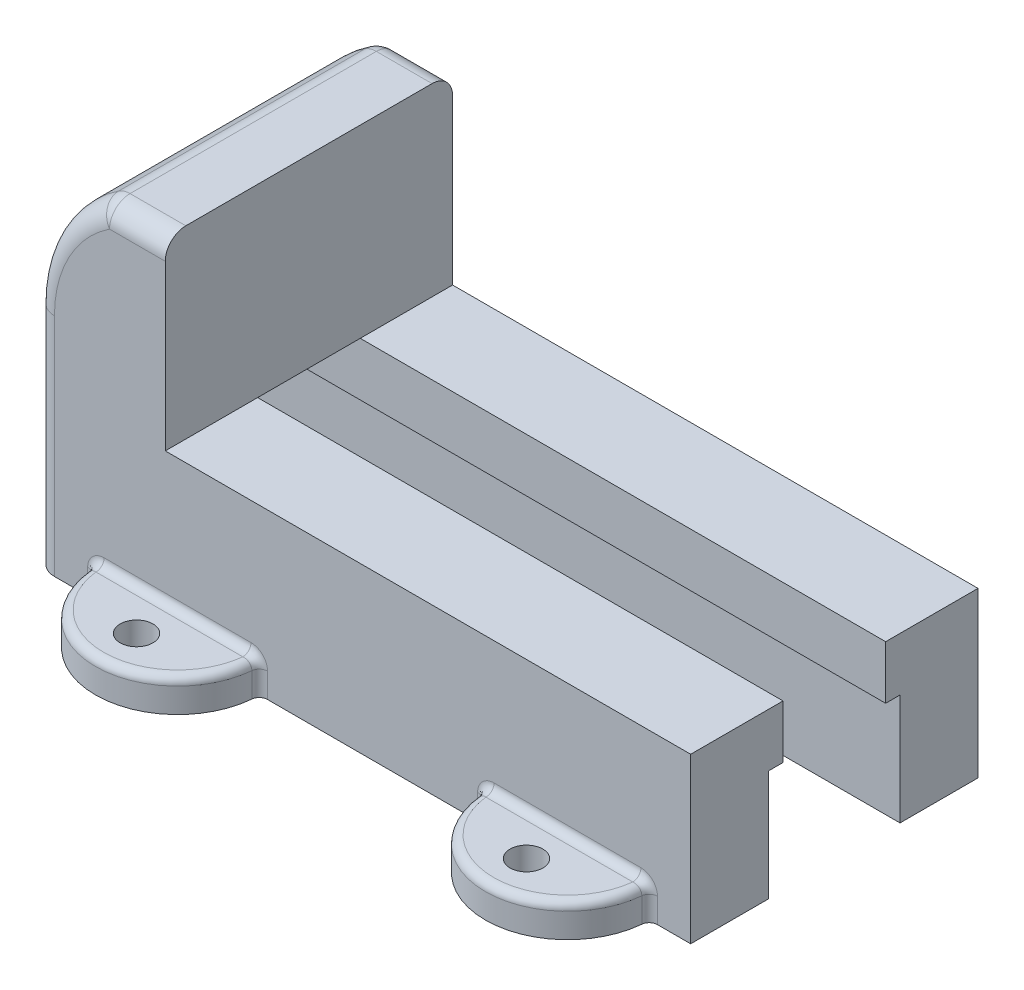
from build123d import *

# Parameters (mm, degrees)
SKETCH1_W                      = 185
SKETCH1_H                      = 40
EXTRUDE1_DEPTH                 = 35
EXTRUDE2_DEPTH                 = 70
EXTRUDE3_DEPTH                 = 25
CUT_EXTRUDE1_DEPTH             = 207.579282601
EXTRUDE4_DEPTH                 = 8
EXTRUDE5_DEPTH                 = 8
F_8_0_8_DIAMETER_HOLE1_D       = 8
F_14_0_14_DIAMETER_HOLE1_D     = 14
F_14_0_14_DIAMETER_HOLE1_DEPTH = 25
FILLET1_R                      = 2
FILLET2_R                      = 2
FILLET3_R                      = 2
FILLET10_R                     = 5
CUT_EXTRUDE2_DEPTH             = 223.598292936
CUT_EXTRUDE2_DEPTH_BACK        = 223.598292936


with BuildPart() as part:
    # Sketch1 → Extrude1 (new, symmetric)
    with BuildSketch(Plane.XY):
        with Locations((92.5, 20)):
            Rectangle(SKETCH1_W, SKETCH1_H)
    extrude(amount=EXTRUDE1_DEPTH, both=True)

    # Sketch2 → Extrude2 (add)
    with BuildSketch(Plane.XY.offset(35)):
        with BuildLine():
            Line((0, 40), (32, 40))
            Line((32, 40), (32, 85))
            Line((32, 85), (16.972243623, 85))
            ThreePointArc((16.972243623, 85), (4.537141687, 72.234101758), (0, 55))
            Line((0, 55), (0, 40))
        make_face()
    extrude(amount=-EXTRUDE2_DEPTH)

    # Sketch3 → Extrude3 (add)
    with BuildSketch(Plane(origin=(185, 0, 0), x_dir=(0, 0, -1), z_dir=(1, 0, 0))):
        with BuildLine():
            Line((-35, 40), (35, 40))
            Line((35, 40), (35, 55))
            Line((35, 55), (17, 55))
            ThreePointArc((17, 55), (0, 72), (-17, 55))
            Line((-17, 55), (-35, 55))
            Line((-35, 55), (-35, 40))
        make_face()
    extrude(amount=-EXTRUDE3_DEPTH)

    # Sketch4 → Cut-Extrude1 (cut, through all)
    with BuildSketch(Plane(origin=(185, 0, 0), x_dir=(0, 0, -1), z_dir=(1, 0, 0))):
        Polygon((-16, 0), (16, 0), (16, 27), (12.5, 27), (12.5, 40), (-12.5, 40), (-12.5, 27), (-16, 27), align=None)
    extrude(amount=-CUT_EXTRUDE1_DEPTH, mode=Mode.SUBTRACT)

    # Sketch5 → Extrude4 (add)
    with BuildSketch(Plane.XZ):
        with BuildLine():
            Line((15, 35), (55, 35))
            ThreePointArc((55, 35), (35, 55), (15, 35))
        make_face()
    extrude4 = extrude(amount=-EXTRUDE4_DEPTH)

    # Sketch6 → Extrude5 (add)
    with BuildSketch(Plane.XZ):
        with BuildLine():
            Line((110, 35), (150, 35))
            ThreePointArc((150, 35), (130, 55), (110, 35))
        make_face()
    extrude5 = extrude(amount=-EXTRUDE5_DEPTH)

    # Mirror1: Extrude4, Extrude5 across plane
    add(extrude4.mirror(Plane.XY))
    add(extrude5.mirror(Plane.XY))

    # Ø8.0 (8) Diameter Hole1 (through all)
    with Locations(Plane(origin=(0, 8, 0), x_dir=(-1, 0, 0), z_dir=(0, 1, 0))):
        with Locations((-35, 45), (-130, 45), (-35, -45), (-130, -45)):
            Hole(F_8_0_8_DIAMETER_HOLE1_D / 2)

    # Ø14.0 (14) Diameter Hole1
    with Locations(Plane(origin=(185, 0, 0), x_dir=(0, 0, -1), z_dir=(1, 0, 0))):
        with Locations((0, 55)):
            Hole(F_14_0_14_DIAMETER_HOLE1_D / 2, depth=F_14_0_14_DIAMETER_HOLE1_DEPTH)

    # Fillet1
    fillet1_edges = [part.edges().sort_by_distance(p)[0] for p in [
        (35, 8, -55),
        (130, 8, -55),
        (35, 8, 55),
        (130, 8, 55),
    ]]
    fillet(fillet1_edges, radius=FILLET1_R)

    # Fillet2
    fillet2_edges = [part.edges().sort_by_distance(p)[0] for p in [
        (130, 8, -35),
        (150, 3, -35),
        (110, 3, -35),
        (35, 8, -35),
        (15, 3, -35),
        (55, 3, -35),
        (150, 3, 35),
        (110, 3, 35),
        (130, 8, 35),
        (55, 3, 35),
        (15, 3, 35),
        (35, 8, 35),
        (110.585786438, 7.414213562, -35),
        (149.414213562, 7.414213562, -35),
        (15.585786438, 7.414213562, -35),
        (54.414213562, 7.414213562, -35),
        (110.585786438, 7.414213562, 35),
        (149.414213562, 7.414213562, 35),
        (15.585786438, 7.414213562, 35),
        (54.414213562, 7.414213562, 35),
        (172.5, 55, 35),
        (172.5, 55, 17),
        (172.5, 55, -17),
        (172.5, 55, -35),
    ]]
    fillet(fillet2_edges, radius=FILLET2_R)

    # Fillet3
    fillet3_edges = [part.edges().sort_by_distance(p)[0] for p in [
        (185, 26.5, 35),
        (185, 55, 25.947221814),
        (185, 55, -25.947221814),
        (185, 72, 0),
        (185, 54.414213562, -34.414213562),
        (185, 54.414213562, 34.414213562),
        (185, 55.513216117, -17.55673152),
        (185, 55.513216117, 17.55673152),
        (185, 26.5, -35),
    ]]
    fillet(fillet3_edges, radius=FILLET3_R)

    # Fillet10
    fillet10_edges = [part.edges().sort_by_distance(p)[0] for p in [
        (4.537141687, 72.234101758, -35),
        (24.486121811, 85, -35),
        (16.972243623, 85, 0),
        (24.486121811, 85, 35),
        (4.537141687, 72.234101758, 35),
        (0, 27.5, 35),
        (0, 27.5, -35),
    ]]
    fillet(fillet10_edges, radius=FILLET10_R)

    # Sketch12 → Cut-Extrude2 (cut, two sides: drawn at the far end of the back side and taken through both)
    with BuildSketch(Plane.XY.offset(35).offset(-CUT_EXTRUDE2_DEPTH_BACK)):
        Polygon((160, 475.924423606), (160, 86.777149485), (160, -16.676761693), (160, -405.824035814), (938.294548242, -405.824035814), (938.294548242, 475.924423606), align=None)
    extrude(amount=CUT_EXTRUDE2_DEPTH + CUT_EXTRUDE2_DEPTH_BACK, mode=Mode.SUBTRACT)


solid = part.part
